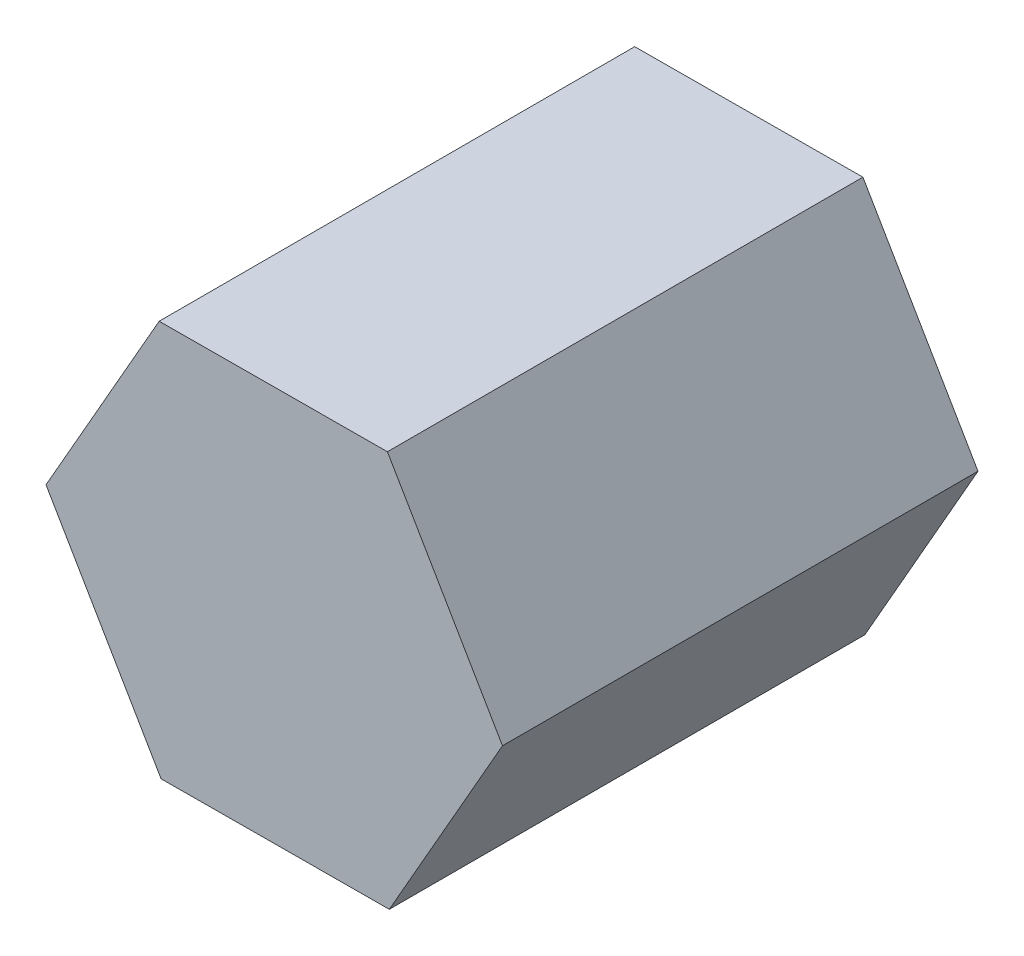
from build123d import *

# Parameters (mm, degrees)
SALIENTE_EXTRUIR1_DEPTH = 50
CROQUIS3_R              = 5
CORTAR_EXTRUIR1_DEPTH   = 10


with BuildPart() as part:
    # Croquis2 → Saliente-Extruir1 (new body)
    with BuildSketch(Plane.XY):
        Polygon((12.100665165, -20.726490631), (24, 0.11623812), (11.899334835, 20.842728751), (-12.100665165, 20.726490631), (-24, -0.11623812), (-11.899334835, -20.842728751), align=None)
    extrude(amount=SALIENTE_EXTRUIR1_DEPTH)

    # Croquis3 → Cortar-Extruir1 (cut)
    with BuildSketch(Plane(origin=(0, 0, 0), x_dir=(-1, 0, 0), z_dir=(0, 0, -1))):
        Circle(CROQUIS3_R)
    extrude(amount=-CORTAR_EXTRUIR1_DEPTH, mode=Mode.SUBTRACT)


solid = part.part
